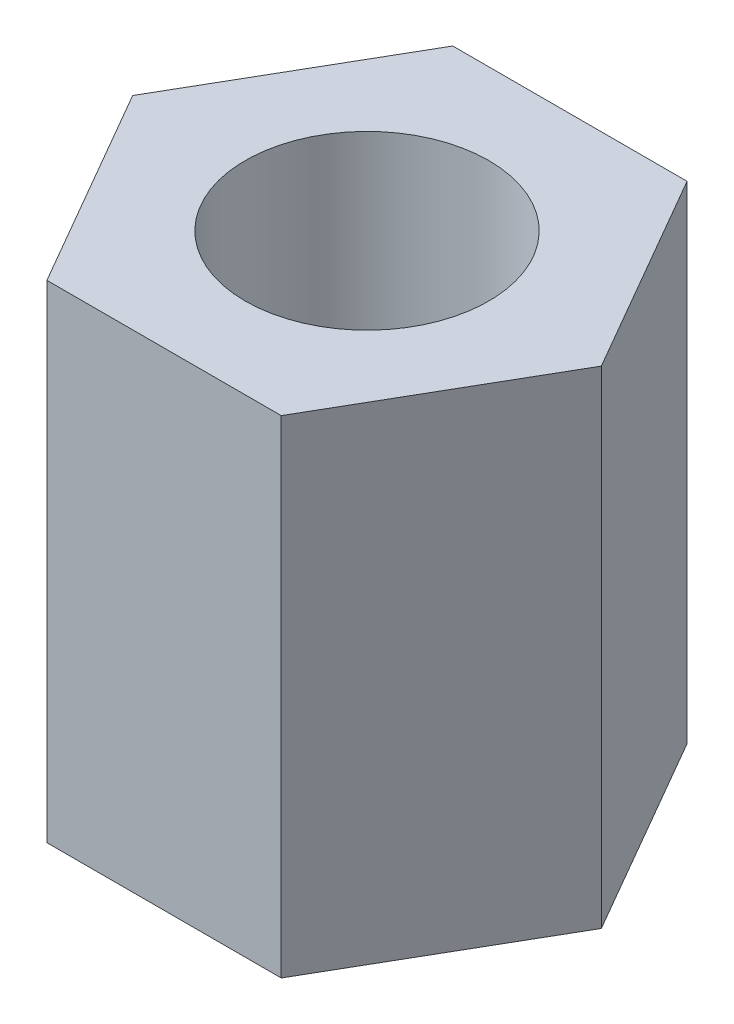
from build123d import *

# Parameters (mm, degrees)
CROQUIS1_R              = 1.5
SALIENTE_EXTRUIR1_DEPTH = 6
CUT_EXTRUDE_START       = -6
SKETCH_1_R              = 1.5
CUT_EXTRUDE_1_DEPTH     = 6


with BuildPart() as part:
    # Croquis1 → Saliente-Extruir1 (new, symmetric)
    with BuildSketch(Plane(origin=(0, 0, 0), x_dir=(1, 0, 0), z_dir=(0, 1, 0))):
        Polygon((1.443375673, -2.5), (2.886751346, 0), (1.443375673, 2.5), (-1.443375673, 2.5), (-2.886751346, 0), (-1.443375673, -2.5), align=None)
        with Locations(Location((0, 0, 0), (0, 0, 270))):
            Circle(CROQUIS1_R, mode=Mode.SUBTRACT)
    extrude(amount=SALIENTE_EXTRUIR1_DEPTH, both=True)

    # 草图1 → 切除-拉伸1 (cut)
    with BuildSketch(Plane(origin=(0, 6, 0), x_dir=(1, 0, 0), z_dir=(0, 1, 0)).offset(CUT_EXTRUDE_START)):
        Polygon((-1.443375673, -2.5), (1.443375673, -2.5), (2.886751346, 0), (1.443375673, 2.5), (-1.443375673, 2.5), (-2.886751346, 0), align=None)
        with Locations(Location((0, 0, 0), (0, 0, 270))):
            Circle(SKETCH_1_R, mode=Mode.SUBTRACT)
    extrude(amount=CUT_EXTRUDE_1_DEPTH, mode=Mode.SUBTRACT)


solid = part.part
